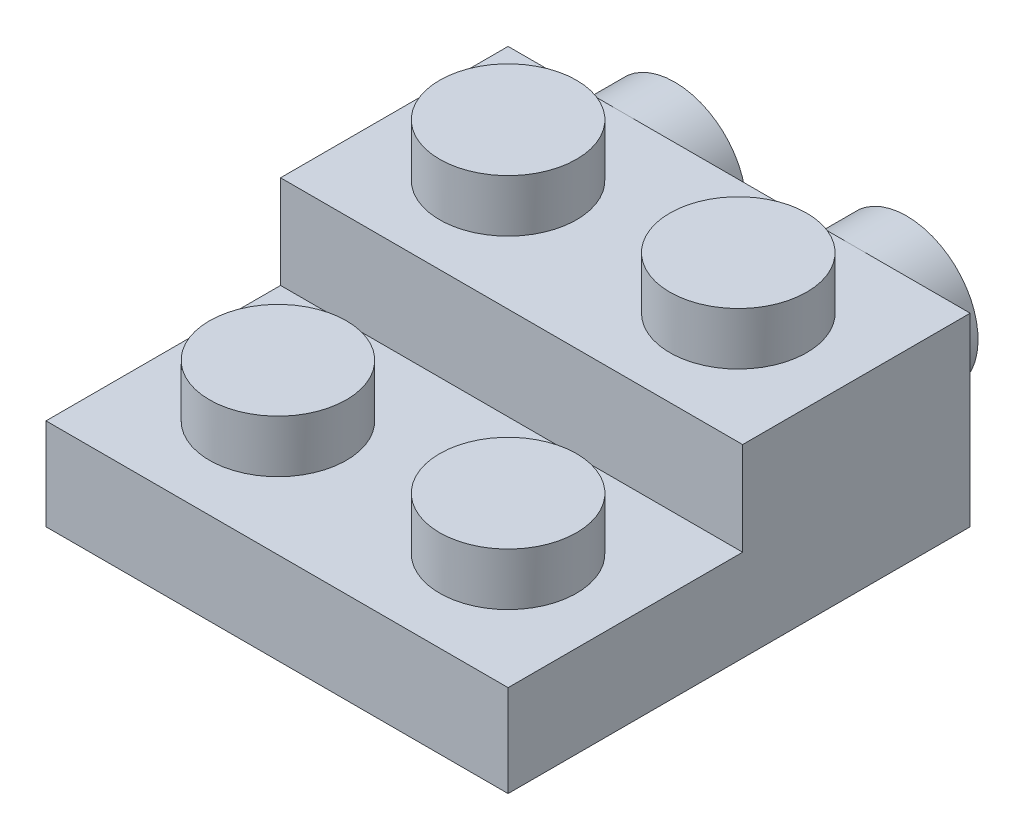
from build123d import *

# Parameters (mm, degrees)
BOSS_EXTRUDE1_DEPTH = 15.86
SKETCH3_R           = 2.35
BOSS_EXTRUDE2_DEPTH = 1.8
SKETCH4_R           = 2.35
BOSS_EXTRUDE3_DEPTH = 1.8
SHELL1_T            = -1.4
SKETCH5_R           = 2.45
SKETCH5_R_2         = 1.45
BOSS_EXTRUDE4_DEPTH = 1.8
SKETCH6_R           = 3.05
SKETCH6_R_2         = 2.395
BOSS_EXTRUDE5_DEPTH = 1.55


with BuildPart() as part:
    # Sketch2 → Boss-Extrude1 (new body)
    with BuildSketch(Plane(origin=(0, 0, 0), x_dir=(0, 0, -1), z_dir=(1, 0, 0))):
        Polygon((0, 0), (0, 6.35), (-7.81, 6.35), (-7.81, 3.15), (-15.86, 3.15), (-15.86, 0), align=None)
    extrude(amount=BOSS_EXTRUDE1_DEPTH)

    # Sketch3 → Boss-Extrude2 (add)
    with BuildSketch(Plane(origin=(0, 6.35, 0), x_dir=(1, 0, 0), z_dir=(0, 1, 0))):
        with Locations(Location((3.98, -3.98, 0), (0, 0, 90))):
            Circle(SKETCH3_R)
        with Locations(Location((11.88, -3.98, 0), (0, 0, 90))):
            Circle(SKETCH3_R)
    extrude(amount=BOSS_EXTRUDE2_DEPTH)

    # Sketch4 → Boss-Extrude3 (add)
    with BuildSketch(Plane(origin=(0, 3.15, 0), x_dir=(1, 0, 0), z_dir=(0, 1, 0))):
        with Locations(Location((3.98, -11.88, 0), (0, 0, 90))):
            Circle(SKETCH4_R)
        with Locations(Location((11.88, -11.88, 0), (0, 0, 90))):
            Circle(SKETCH4_R)
    extrude(amount=BOSS_EXTRUDE3_DEPTH)

    # Shell1
    shell1_openings = [part.faces().sort_by_distance(p)[0] for p in [
        (7.93, 0, 7.93),
    ]]
    offset(amount=SHELL1_T, openings=shell1_openings, kind=Kind.INTERSECTION)

    # Sketch5 → Boss-Extrude4 (add)
    # profile 1 of 2: a face of its own
    with BuildSketch(Plane(origin=(0, 0, 0), x_dir=(-1, 0, 0), z_dir=(0, 0, -1))):
        with Locations(Location((-11.88, 3.9, 0), (0, 0, 90))):
            Circle(SKETCH5_R)
        with Locations((-11.88, 3.9)):
            Circle(SKETCH5_R_2, mode=Mode.SUBTRACT)
    # profile 2 of 2: a face of its own
    with BuildSketch(Plane(origin=(0, 0, 0), x_dir=(-1, 0, 0), z_dir=(0, 0, -1))):
        with Locations(Location((-3.92, 3.9, 0), (0, 0, 90))):
            Circle(SKETCH5_R)
        with Locations((-3.92, 3.9)):
            Circle(SKETCH5_R_2, mode=Mode.SUBTRACT)
    extrude(amount=BOSS_EXTRUDE4_DEPTH)

    # Sketch6 → Boss-Extrude5 (add)
    with BuildSketch(Plane.XZ.offset(-1.75)):
        with Locations(Location((7.93, 7.93, 0), (0, 0, 90))):
            Circle(SKETCH6_R)
        with Locations(Location((7.93, 7.93, 0), (0, 0, 90))):
            Circle(SKETCH6_R_2, mode=Mode.SUBTRACT)
    extrude(amount=BOSS_EXTRUDE5_DEPTH)


solid = part.part
